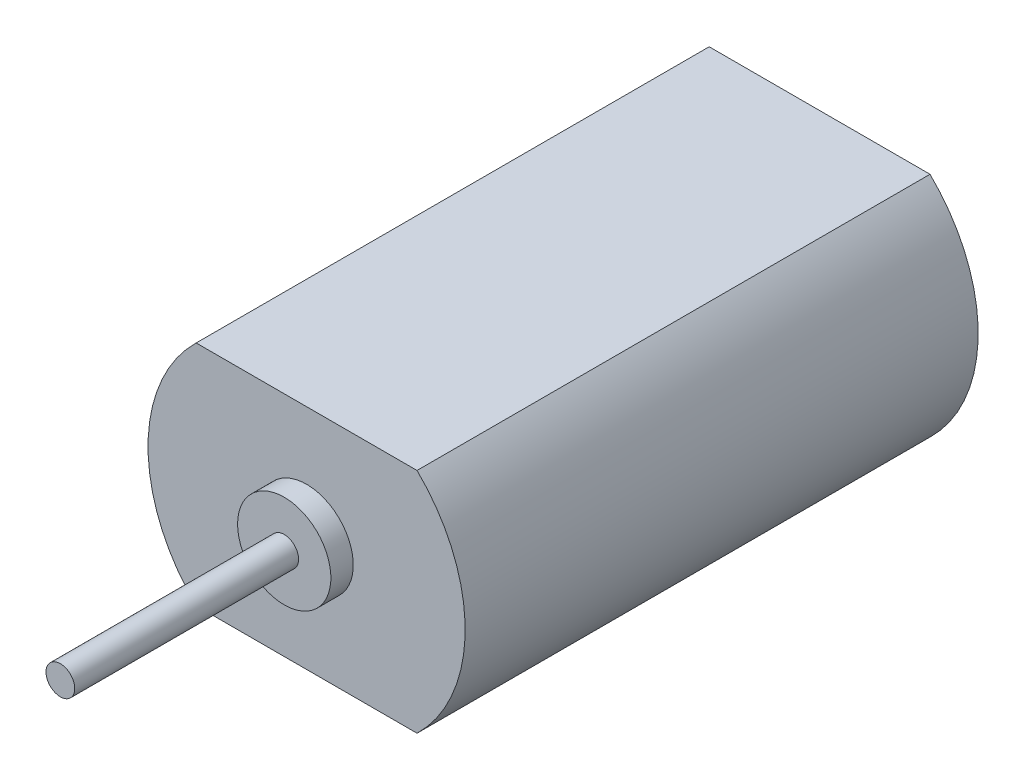
from build123d import *

# Parameters (mm, degrees)
BOSS_EXTRUDE1_DEPTH = 34.925
SKETCH2_R           = 3.175
BOSS_EXTRUDE2_DEPTH = 1.524
SKETCH3_R           = 0.9779
BOSS_EXTRUDE3_DEPTH = 15.24
BOSS_EXTRUDE4_START = 6.35
SKETCH4_R           = 0.9779
BOSS_EXTRUDE4_DEPTH = 6.35
SKETCH5_W           = 1.016
SKETCH5_H           = 2.032
BOSS_EXTRUDE5_DEPTH = 2.032


with BuildPart() as part:
    # Sketch1 → Boss-Extrude1 (new body)
    with BuildSketch(Plane.XY):
        with BuildLine():
            Line((7.517713482, 7.747), (-7.517713482, 7.747))
            ThreePointArc((-7.517713482, 7.747), (-10.795, 0), (-7.517713482, -7.747))
            Line((-7.517713482, -7.747), (7.517713482, -7.747))
            ThreePointArc((7.517713482, -7.747), (9.941975207, -4.205847594), (10.795, 0))
            ThreePointArc((10.795, 0), (9.941975207, 4.205847594), (7.517713482, 7.747))
        make_face()
    extrude(amount=BOSS_EXTRUDE1_DEPTH)

    # Sketch2 → Boss-Extrude2 (add)
    with BuildSketch(Plane.XY.offset(34.925)):
        with Locations(Location((0, 0, 0), (0, 0, 180))):
            Circle(SKETCH2_R)
    extrude(amount=BOSS_EXTRUDE2_DEPTH)

    # Sketch3 → Boss-Extrude3 (add)
    with BuildSketch(Plane.XY.offset(36.449)):
        with Locations(Location((0, 0, 0), (0, 0, 180))):
            Circle(SKETCH3_R)
    extrude(amount=BOSS_EXTRUDE3_DEPTH)

    # Sketch4 → Boss-Extrude4 (add)
    with BuildSketch(Plane(origin=(0, 0, 0), x_dir=(-1, 0, 0), z_dir=(0, 0, -1)).offset(BOSS_EXTRUDE4_START)):
        Circle(SKETCH4_R)
    extrude(amount=-BOSS_EXTRUDE4_DEPTH)

    # Sketch5 → Boss-Extrude5 (add)
    with BuildSketch(Plane(origin=(0, 0, 0), x_dir=(-1, 0, 0), z_dir=(0, 0, -1))):
        with Locations((-7.493, 0)):
            Rectangle(SKETCH5_W, SKETCH5_H)
        with Locations((7.493, 0)):
            Rectangle(SKETCH5_W, SKETCH5_H)
    extrude(amount=BOSS_EXTRUDE5_DEPTH)


solid = part.part
